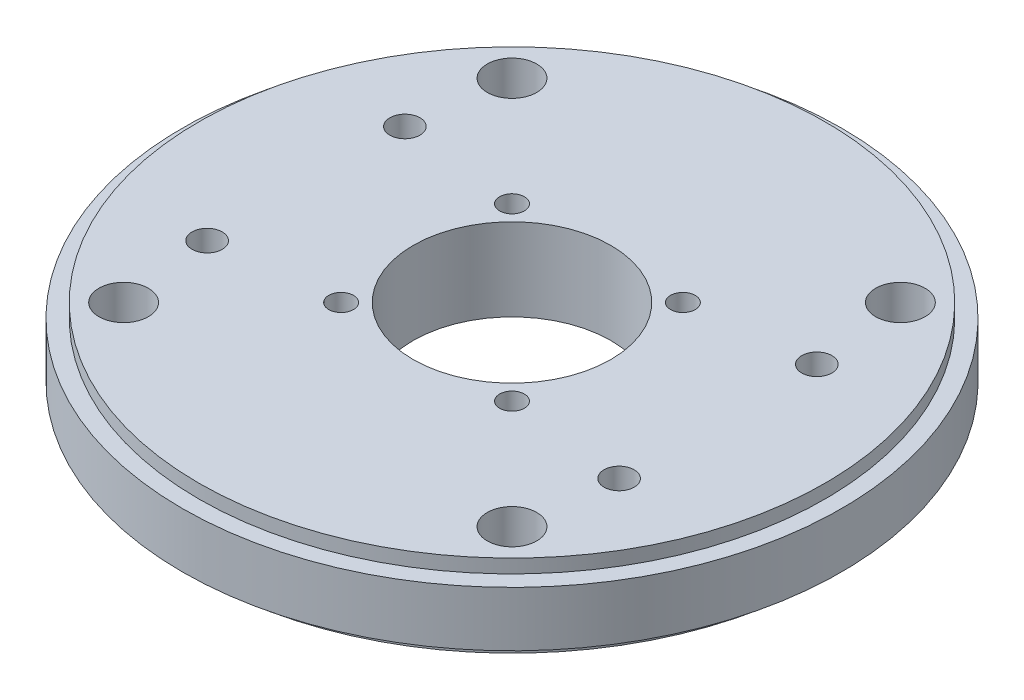
from build123d import *

# Parameters (mm, degrees)
SKETCH1_R                  = 57
EXTRUDE4_DEPTH             = 7.5
SKETCH_R                   = 60
SKETCH_R_2                 = 57
EXTRUDE5_DEPTH             = 5
EXTRUDE6_DEPTH             = 86.183625187
EXTRUDE6_DEPTH_BACK        = 86.183625187
SKETCH5_R                  = 18
F_4_5_4_5_DIAMETER_HOLE1_D = 4.5
CIRPATTERN1_COUNT          = 4
M5_CLEARANCE_HOLE1_D       = 5.5
M8_CLEARANCE_HOLE2_D       = 9
CIRPATTERN3_COUNT          = 4


with BuildPart() as part:
    # Sketch1 → Extrude4 (new, symmetric)
    with BuildSketch(Plane(origin=(0, 0, 0), x_dir=(1, 0, 0), z_dir=(0, 1, 0))):
        Circle(SKETCH1_R)
    extrude(amount=EXTRUDE4_DEPTH, both=True)

    # Sketch → Extrude5 (add, symmetric)
    with BuildSketch(Plane(origin=(0, 0, 0), x_dir=(1, 0, 0), z_dir=(0, 1, 0))):
        Circle(SKETCH_R)
        Circle(SKETCH_R_2, mode=Mode.SUBTRACT)
    extrude(amount=EXTRUDE5_DEPTH, both=True)

    # Sketch5 → Extrude6 (cut, two sides: drawn at the far end of the back side and taken through both)
    with BuildSketch(Plane(origin=(0, 0, 0), x_dir=(1, 0, 0), z_dir=(0, 1, 0)).offset(-EXTRUDE6_DEPTH_BACK)):
        Circle(SKETCH5_R)
    extrude(amount=EXTRUDE6_DEPTH + EXTRUDE6_DEPTH_BACK, mode=Mode.SUBTRACT)

    # Ø4.5 (4.5) Diameter Hole1 (through all)
    with Locations(Plane(origin=(0, -7.5, 0), x_dir=(-1, 0, 0), z_dir=(0, -1, 0))):
        with Locations((15.556349186, 15.556349186)):
            f_4_5_4_5_diameter_hole1 = Hole(F_4_5_4_5_DIAMETER_HOLE1_D / 2)

    # CirPattern1: Ø4.5 (4.5) Diameter Hole1 ×4 about axis
    cirpattern1_axis = Axis((0, -8.25, 0), (0, 1, 0))
    for i in range(1, CIRPATTERN1_COUNT):
        add(f_4_5_4_5_diameter_hole1.rotate(cirpattern1_axis, i * 360 / CIRPATTERN1_COUNT), mode=Mode.SUBTRACT)

    # M5 Clearance Hole1 (through all)
    with Locations(Plane(origin=(0, 7.5, 0), x_dir=(1, 0, 0), z_dir=(0, 1, 0))):
        with Locations((-37.5, 18), (-37.5, -18), (37.5, -18), (37.5, 18)):
            Hole(M5_CLEARANCE_HOLE1_D / 2)

    # M8 Clearance Hole2 (through all)
    with Locations(Plane(origin=(0, 7.5, 0), x_dir=(1, 0, 0), z_dir=(0, 1, 0))):
        with Locations((-35.355339059, -35.355339059)):
            m8_clearance_hole2 = Hole(M8_CLEARANCE_HOLE2_D / 2)

    # CirPattern3: M8 Clearance Hole2 ×4 about axis
    cirpattern3_axis = Axis((0, -8.25, 0), (0, 1, 0))
    for i in range(1, CIRPATTERN3_COUNT):
        add(m8_clearance_hole2.rotate(cirpattern3_axis, i * 360 / CIRPATTERN3_COUNT), mode=Mode.SUBTRACT)


solid = part.part
